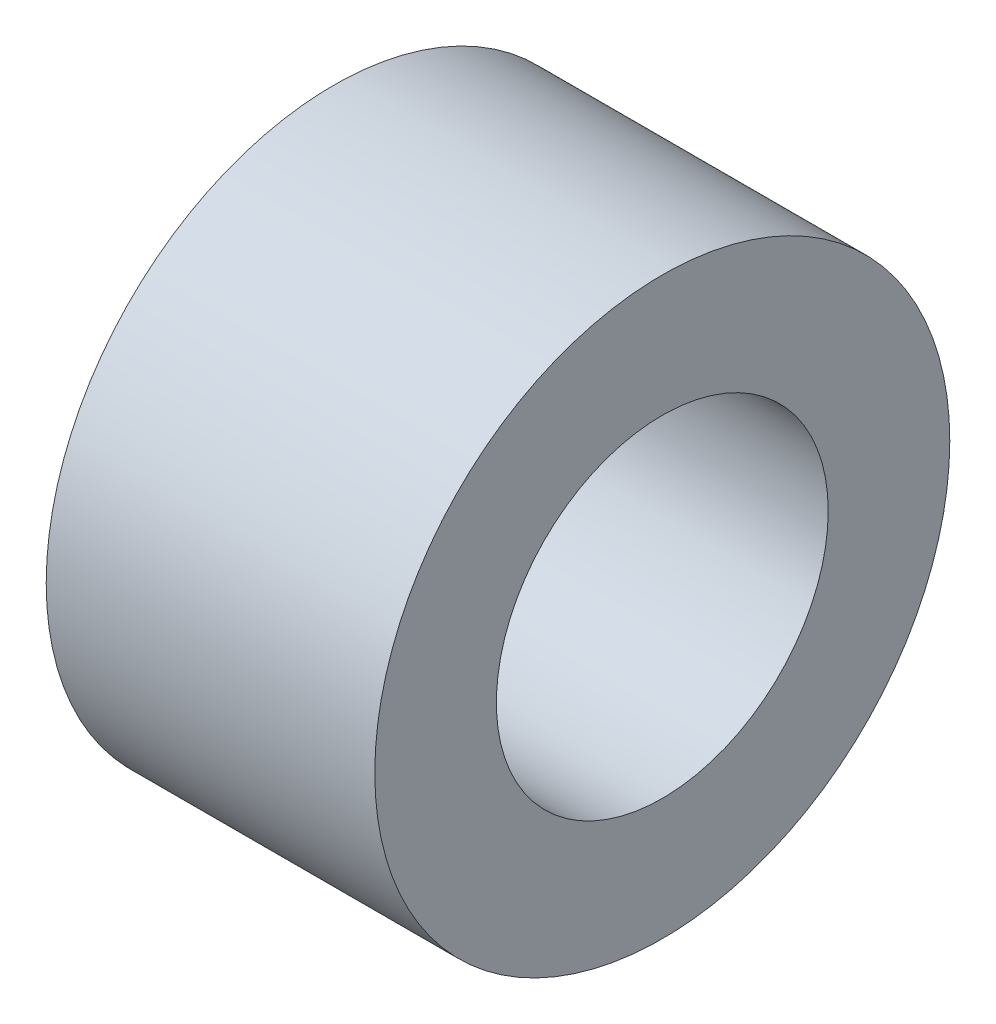
from build123d import *

# Parameters (mm, degrees)
SKETCH1_R           = 11.1125
SKETCH1_R_2         = 6.4135
BOSS_EXTRUDE1_DEPTH = 12.7


with BuildPart() as part:
    # Sketch1 → Boss-Extrude1 (new body)
    with BuildSketch(Plane.YZ):
        with Locations(Location((0, 0, 0), (0, 0, 270))):
            Circle(SKETCH1_R)
        with Locations(Location((0, 0, 0), (0, 0, 270))):
            Circle(SKETCH1_R_2, mode=Mode.SUBTRACT)
    extrude(amount=BOSS_EXTRUDE1_DEPTH)


solid = part.part
